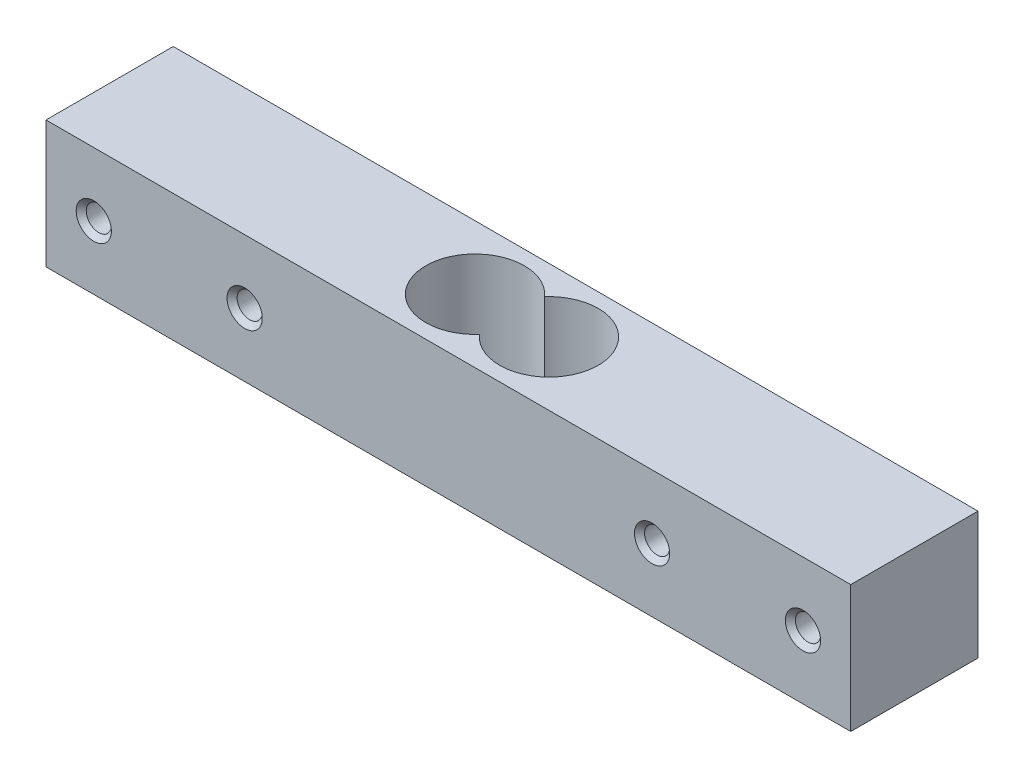
from build123d import *

# Parameters (mm, degrees)
SKETCH1_W                  = 80
SKETCH1_H                  = 12.65
BOSS_EXTRUDE1_DEPTH        = 6.325
M3_TAPPED_HOLE1_AT_2_COUNT = 2
M3_TAPPED_HOLE1_AT_2_PITCH = 15
M3_TAPPED_HOLE1_AT_3_COUNT = 2
M3_TAPPED_HOLE1_AT_3_PITCH = 55.5
M3_TAPPED_HOLE1_AT_4_COUNT = 2
M3_TAPPED_HOLE1_AT_4_PITCH = 70.5


with BuildPart() as part:
    # Sketch1 → Boss-Extrude1 (new, symmetric)
    with BuildSketch(Plane(origin=(0, 0, 0), x_dir=(1, 0, 0), z_dir=(0, 1, 0))):
        Rectangle(SKETCH1_W, SKETCH1_H)
        with BuildLine():
            ThreePointArc((0, -3.241045356), (-8.575, 0), (0, 3.241045356))
            ThreePointArc((0, 3.241045356), (5.407411614, 4.583530299), (8.575, 0))
            ThreePointArc((8.575, 0), (5.407411614, -4.583530299), (0, -3.241045356))
        make_face(mode=Mode.SUBTRACT)
    extrude(amount=BOSS_EXTRUDE1_DEPTH, both=True)

    # Sketch5 → M3 Tapped Hole1 (revolve, cut)
    with BuildSketch(Plane(origin=(-35.25, 0, -6.325), x_dir=(0, 1, 0), z_dir=(1, 0, 0))):
        Polygon((0, 0), (0, 12.65), (1.75, 12.65), (1.25, 12.15), (1.25, 0.5), (1.75, 0), align=None)
    m3_tapped_hole1 = revolve(axis=Axis((-35.25, 0, -12.675), (0, 0, 1)), mode=Mode.SUBTRACT)

    # M3 Tapped Hole1 at 2: M3 Tapped Hole1 ×2
    with Locations(*[(i * M3_TAPPED_HOLE1_AT_2_PITCH, 0, 0) for i in range(1, M3_TAPPED_HOLE1_AT_2_COUNT)]):
        add(m3_tapped_hole1, mode=Mode.SUBTRACT)

    # M3 Tapped Hole1 at 3: M3 Tapped Hole1 ×2
    with Locations(*[(i * M3_TAPPED_HOLE1_AT_3_PITCH, 0, 0) for i in range(1, M3_TAPPED_HOLE1_AT_3_COUNT)]):
        add(m3_tapped_hole1, mode=Mode.SUBTRACT)

    # M3 Tapped Hole1 at 4: M3 Tapped Hole1 ×2
    with Locations(*[(i * M3_TAPPED_HOLE1_AT_4_PITCH, 0, 0) for i in range(1, M3_TAPPED_HOLE1_AT_4_COUNT)]):
        add(m3_tapped_hole1, mode=Mode.SUBTRACT)


solid = part.part
